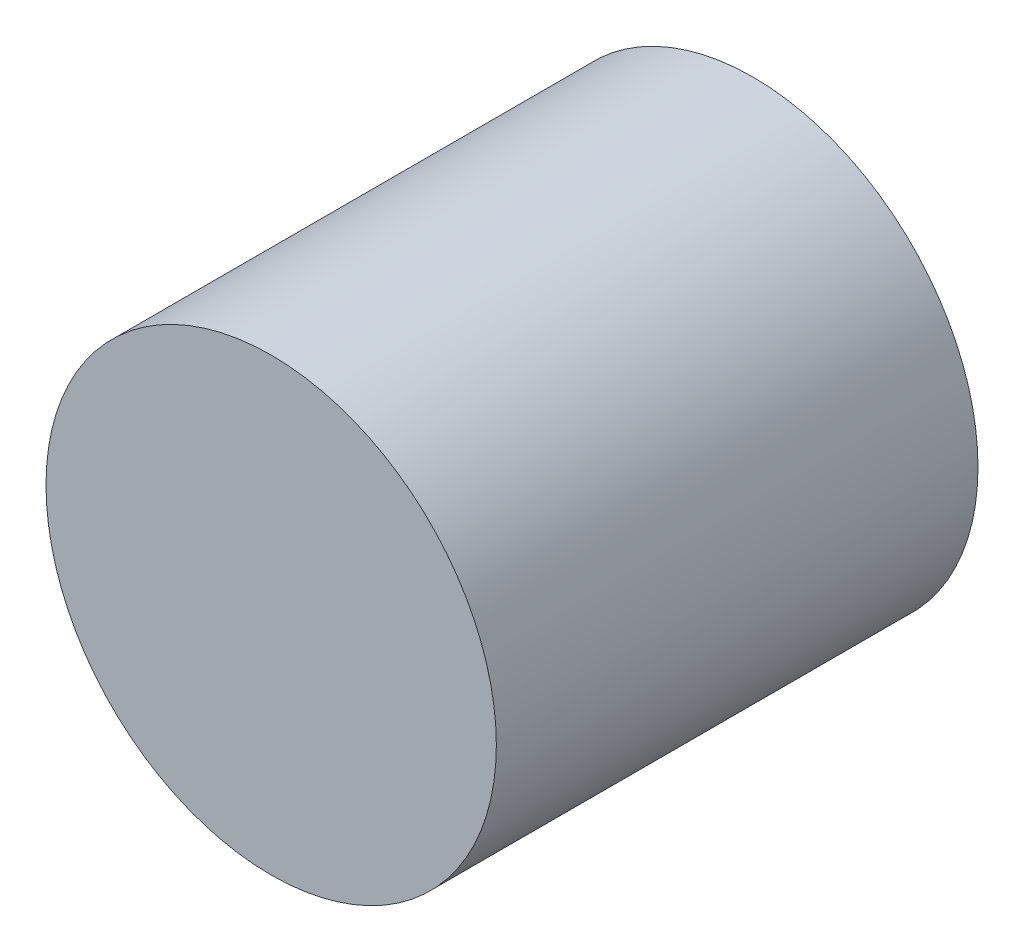
from build123d import *

# Parameters (mm, degrees)
SKETCH1_R           = 23.749
BOSS_EXTRUDE1_DEPTH = 50.8


with BuildPart() as part:
    # Sketch1 → Boss-Extrude1 (new body)
    with BuildSketch(Plane.XY):
        Circle(SKETCH1_R)
    extrude(amount=BOSS_EXTRUDE1_DEPTH)


solid = part.part
